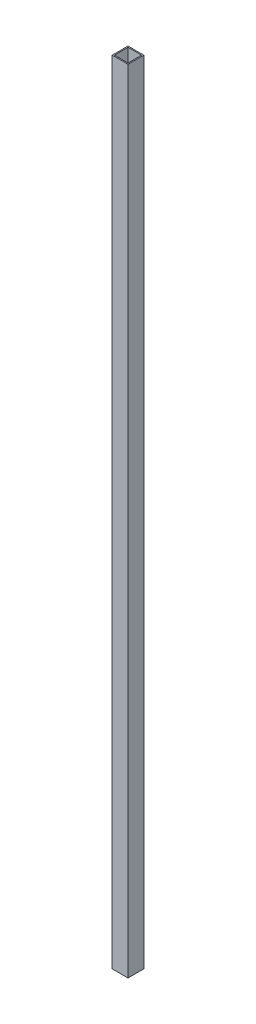
from build123d import *

# Parameters (mm, degrees)
SKETCH_1_W      = 50
SKETCH_1_H      = 50
SKETCH_1_W_2    = 43.07525768
SKETCH_1_H_2    = 43.07525768
EXTRUDE_1_DEPTH = 2500


with BuildPart() as part:
    # Эскиз1 → Бобышка-Вытянуть1 (new body)
    with BuildSketch(Plane(origin=(0, 0, 0), x_dir=(1, 0, 0), z_dir=(0, 1, 0))):
        Rectangle(SKETCH_1_W, SKETCH_1_H)
        Rectangle(SKETCH_1_W_2, SKETCH_1_H_2, mode=Mode.SUBTRACT)
    extrude(amount=EXTRUDE_1_DEPTH)


solid = part.part
